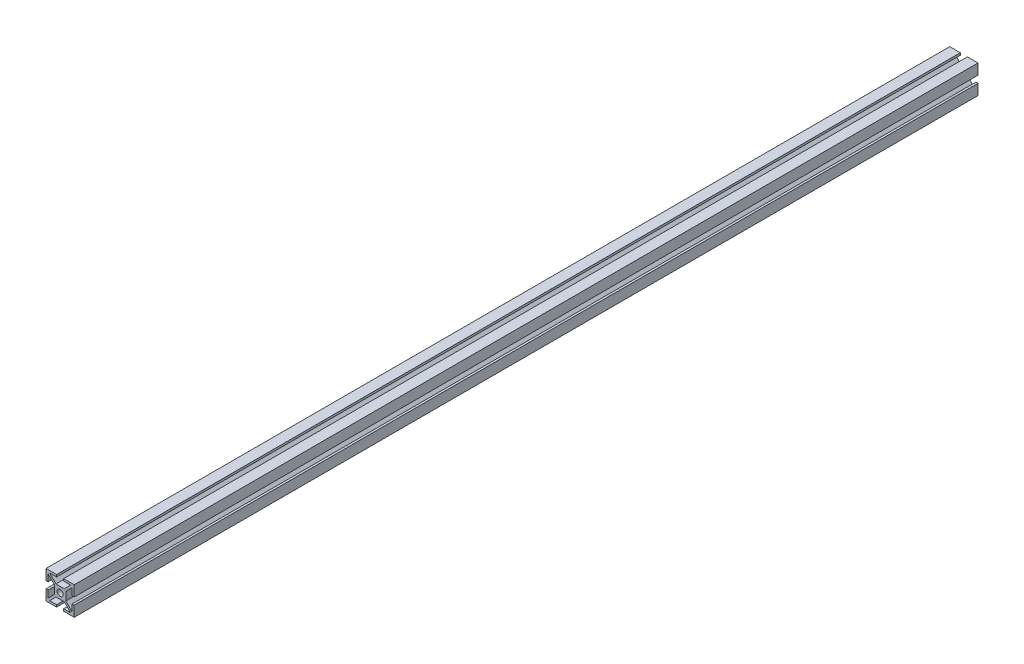
from build123d import *

# Parameters (mm, degrees)
SKIZZE2_R                       = 2.15
AUFSATZ_LINEAR_AUSTRAGEN1_DEPTH = 640


with BuildPart() as part:
    # Skizze2 → Aufsatz-Linear austragen1 (new body)
    with BuildSketch(Plane.XY):
        Polygon((-10, -2.5), (-10, -10), (-2.5, -10), (-2.5, -8.5), (-7.439339828, -8.5), (-2.939339828, -4), (2.939339828, -4), (7.439339828, -8.5), (2.5, -8.5), (2.5, -10), (10, -10), (10, -2.5), (8.495523259, -2.5), (8.495523259, -7.434863087), (4, -2.939339828), (4, 2.939339828), (8.495523259, 7.434863087), (8.495523259, 2.5), (10, 2.5), (10, 10), (2.5, 10), (2.5, 8.5), (7.439339828, 8.5), (2.939339828, 4), (-2.939339828, 4), (-7.439339828, 8.5), (-2.5, 8.5), (-2.5, 10), (-10, 10), (-10, 2.5), (-8.5, 2.5), (-8.5, 7.439339828), (-4, 2.939339828), (-4, -2.939339828), (-8.5, -7.439339828), (-8.5, -2.5), align=None)
        Circle(SKIZZE2_R, mode=Mode.SUBTRACT)
    extrude(amount=AUFSATZ_LINEAR_AUSTRAGEN1_DEPTH)


solid = part.part
